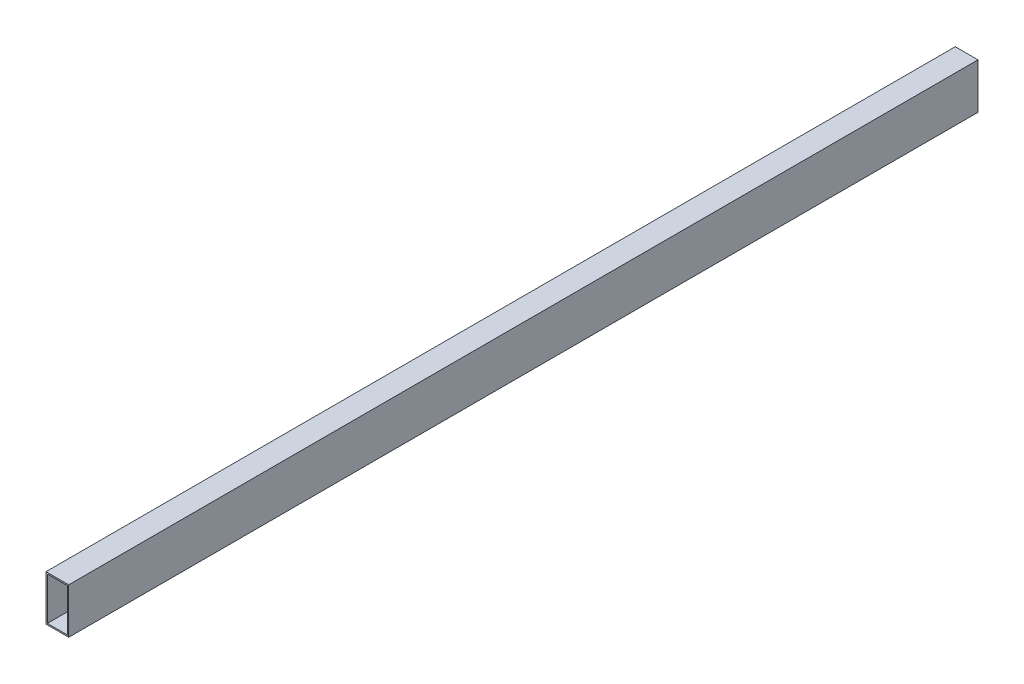
from build123d import *

# Parameters (mm, degrees)
SKETCH1_W           = 25.4
SKETCH1_H           = 50.8
SKETCH1_W_2         = 22.352
SKETCH1_H_2         = 47.752
EXTRUDE_THIN1_DEPTH = 1016


with BuildPart() as part:
    # Sketch1 → Extrude-Thin1 (new body)
    with BuildSketch(Plane.XY):
        with Locations((12.7, 25.4)):
            Rectangle(SKETCH1_W, SKETCH1_H)
        with Locations((12.7, 25.4)):
            Rectangle(SKETCH1_W_2, SKETCH1_H_2, mode=Mode.SUBTRACT)
    extrude(amount=EXTRUDE_THIN1_DEPTH)


solid = part.part
